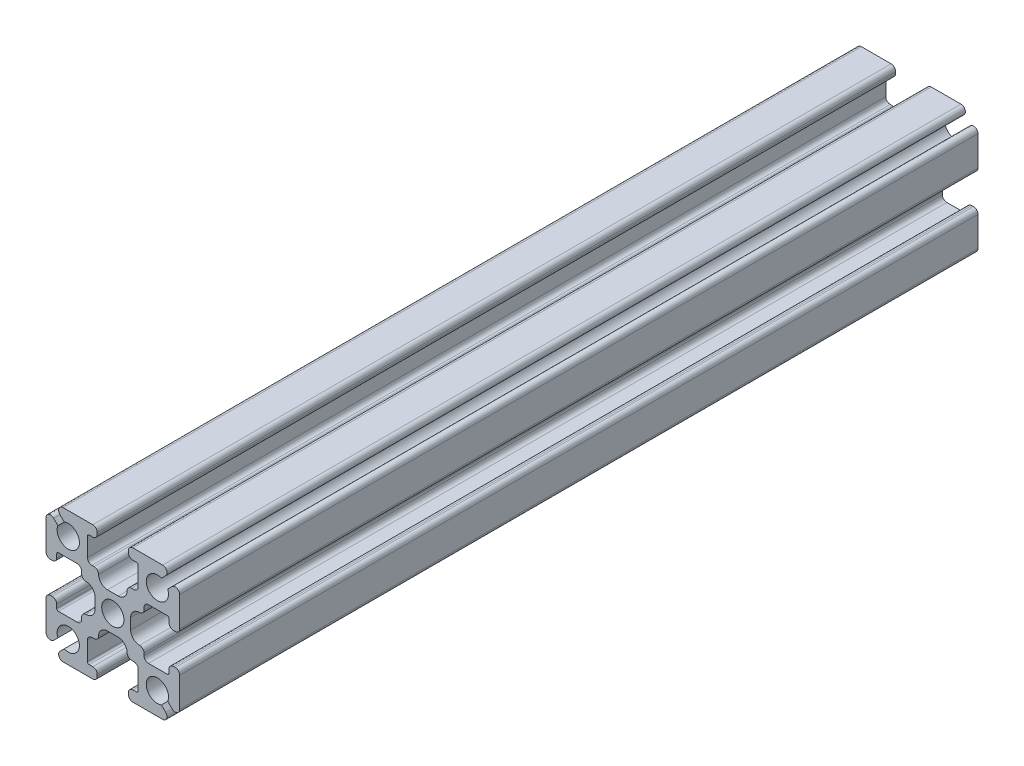
from build123d import *

# Parameters (mm, degrees)
SKETCH1_R           = 1.25
BOSS_EXTRUDE1_DEPTH = 89.6


with BuildPart() as part:
    # Sketch1 → Boss-Extrude1 (new body)
    with BuildSketch(Plane.XY):
        with BuildLine():
            Line((6.646446609, 5.939339828), (6.163645978, 5.456539197))
            ThreePointArc((6.163645978, 5.456539197), (4.116116524, 4.116116524), (5.456539197, 6.163645978))
            Line((5.456539197, 6.163645978), (5.939339828, 6.646446609))
            ThreePointArc((5.939339828, 6.646446609), (6.047726204, 7.191341716), (5.585786438, 7.5))
            Line((5.585786438, 7.5), (2.25, 7.5))
            ThreePointArc((2.25, 7.5), (1.896446609, 7.353553391), (1.75, 7))
            Line((1.75, 7), (1.75, 6.8))
            ThreePointArc((1.75, 6.8), (1.896446609, 6.446446609), (2.25, 6.3))
            Line((2.25, 6.3), (2.65, 6.3))
            ThreePointArc((2.65, 6.3), (2.791421356, 6.241421356), (2.85, 6.1))
            Line((2.85, 6.1), (2.85, 4))
            ThreePointArc((2.85, 4), (2.703553391, 3.646446609), (2.35, 3.5))
            Line((2.35, 3.5), (2.1, 3.5))
            ThreePointArc((2.1, 3.5), (1.746446609, 3.353553391), (1.6, 3))
            ThreePointArc((1.6, 3), (1.307106781, 2.292893219), (0.6, 2))
            Line((0.6, 2), (-0.6, 2))
            ThreePointArc((-0.6, 2), (-1.307106781, 2.292893219), (-1.6, 3))
            ThreePointArc((-1.6, 3), (-1.746446609, 3.353553391), (-2.1, 3.5))
            Line((-2.1, 3.5), (-2.35, 3.5))
            ThreePointArc((-2.35, 3.5), (-2.703553391, 3.646446609), (-2.85, 4))
            Line((-2.85, 4), (-2.85, 6.1))
            ThreePointArc((-2.85, 6.1), (-2.791421356, 6.241421356), (-2.65, 6.3))
            Line((-2.65, 6.3), (-2.25, 6.3))
            ThreePointArc((-2.25, 6.3), (-1.896446609, 6.446446609), (-1.75, 6.8))
            Line((-1.75, 6.8), (-1.75, 7))
            ThreePointArc((-1.75, 7), (-1.896446609, 7.353553391), (-2.25, 7.5))
            Line((-2.25, 7.5), (-5.585786438, 7.5))
            ThreePointArc((-5.585786438, 7.5), (-6.047726204, 7.191341716), (-5.939339828, 6.646446609))
            Line((-5.939339828, 6.646446609), (-5.456539197, 6.163645978))
            ThreePointArc((-5.456539197, 6.163645978), (-4.116116524, 4.116116524), (-6.163645978, 5.456539197))
            Line((-6.163645978, 5.456539197), (-6.646446609, 5.939339828))
            ThreePointArc((-6.646446609, 5.939339828), (-7.191341716, 6.047726204), (-7.5, 5.585786438))
            Line((-7.5, 5.585786438), (-7.5, 2.25))
            ThreePointArc((-7.5, 2.25), (-7.353553391, 1.896446609), (-7, 1.75))
            Line((-7, 1.75), (-6.8, 1.75))
            ThreePointArc((-6.8, 1.75), (-6.446446609, 1.896446609), (-6.3, 2.25))
            Line((-6.3, 2.25), (-6.3, 2.65))
            ThreePointArc((-6.3, 2.65), (-6.241421356, 2.791421356), (-6.1, 2.85))
            Line((-6.1, 2.85), (-4, 2.85))
            ThreePointArc((-4, 2.85), (-3.646446609, 2.703553391), (-3.5, 2.35))
            Line((-3.5, 2.35), (-3.5, 2.1))
            ThreePointArc((-3.5, 2.1), (-3.353553391, 1.746446609), (-3, 1.6))
            ThreePointArc((-3, 1.6), (-2.292893219, 1.307106781), (-2, 0.6))
            Line((-2, 0.6), (-2, -0.6))
            ThreePointArc((-2, -0.6), (-2.292893219, -1.307106781), (-3, -1.6))
            ThreePointArc((-3, -1.6), (-3.353553391, -1.746446609), (-3.5, -2.1))
            Line((-3.5, -2.1), (-3.5, -2.35))
            ThreePointArc((-3.5, -2.35), (-3.646446609, -2.703553391), (-4, -2.85))
            Line((-4, -2.85), (-6.1, -2.85))
            ThreePointArc((-6.1, -2.85), (-6.241421356, -2.791421356), (-6.3, -2.65))
            Line((-6.3, -2.65), (-6.3, -2.25))
            ThreePointArc((-6.3, -2.25), (-6.446446609, -1.896446609), (-6.8, -1.75))
            Line((-6.8, -1.75), (-7, -1.75))
            ThreePointArc((-7, -1.75), (-7.353553391, -1.896446609), (-7.5, -2.25))
            Line((-7.5, -2.25), (-7.5, -5.585786438))
            ThreePointArc((-7.5, -5.585786438), (-7.191341716, -6.047726204), (-6.646446609, -5.939339828))
            Line((-6.646446609, -5.939339828), (-6.163645978, -5.456539197))
            ThreePointArc((-6.163645978, -5.456539197), (-4.116116524, -4.116116524), (-5.456539197, -6.163645978))
            Line((-5.456539197, -6.163645978), (-5.939339828, -6.646446609))
            ThreePointArc((-5.939339828, -6.646446609), (-6.047726204, -7.191341716), (-5.585786438, -7.5))
            Line((-5.585786438, -7.5), (-2.25, -7.5))
            ThreePointArc((-2.25, -7.5), (-1.896446609, -7.353553391), (-1.75, -7))
            Line((-1.75, -7), (-1.75, -6.8))
            ThreePointArc((-1.75, -6.8), (-1.896446609, -6.446446609), (-2.25, -6.3))
            Line((-2.25, -6.3), (-2.65, -6.3))
            ThreePointArc((-2.65, -6.3), (-2.791421356, -6.241421356), (-2.85, -6.1))
            Line((-2.85, -6.1), (-2.85, -4))
            ThreePointArc((-2.85, -4), (-2.703553391, -3.646446609), (-2.35, -3.5))
            Line((-2.35, -3.5), (-2.1, -3.5))
            ThreePointArc((-2.1, -3.5), (-1.746446609, -3.353553391), (-1.6, -3))
            ThreePointArc((-1.6, -3), (-1.307106781, -2.292893219), (-0.6, -2))
            Line((-0.6, -2), (0.6, -2))
            ThreePointArc((0.6, -2), (1.307106781, -2.292893219), (1.6, -3))
            ThreePointArc((1.6, -3), (1.746446609, -3.353553391), (2.1, -3.5))
            Line((2.1, -3.5), (2.35, -3.5))
            ThreePointArc((2.35, -3.5), (2.703553391, -3.646446609), (2.85, -4))
            Line((2.85, -4), (2.85, -6.1))
            ThreePointArc((2.85, -6.1), (2.791421356, -6.241421356), (2.65, -6.3))
            Line((2.65, -6.3), (2.25, -6.3))
            ThreePointArc((2.25, -6.3), (1.896446609, -6.446446609), (1.75, -6.8))
            Line((1.75, -6.8), (1.75, -7))
            ThreePointArc((1.75, -7), (1.896446609, -7.353553391), (2.25, -7.5))
            Line((2.25, -7.5), (5.585786438, -7.5))
            ThreePointArc((5.585786438, -7.5), (6.047726204, -7.191341716), (5.939339828, -6.646446609))
            Line((5.939339828, -6.646446609), (5.456539197, -6.163645978))
            ThreePointArc((5.456539197, -6.163645978), (4.116116524, -4.116116524), (6.163645978, -5.456539197))
            Line((6.163645978, -5.456539197), (6.646446609, -5.939339828))
            ThreePointArc((6.646446609, -5.939339828), (7.191341716, -6.047726204), (7.5, -5.585786438))
            Line((7.5, -5.585786438), (7.5, -2.25))
            ThreePointArc((7.5, -2.25), (7.353553391, -1.896446609), (7, -1.75))
            Line((7, -1.75), (6.8, -1.75))
            ThreePointArc((6.8, -1.75), (6.446446609, -1.896446609), (6.3, -2.25))
            Line((6.3, -2.25), (6.3, -2.65))
            ThreePointArc((6.3, -2.65), (6.241421356, -2.791421356), (6.1, -2.85))
            Line((6.1, -2.85), (4, -2.85))
            ThreePointArc((4, -2.85), (3.646446609, -2.703553391), (3.5, -2.35))
            Line((3.5, -2.35), (3.5, -2.1))
            ThreePointArc((3.5, -2.1), (3.353553391, -1.746446609), (3, -1.6))
            ThreePointArc((3, -1.6), (2.292893219, -1.307106781), (2, -0.6))
            Line((2, -0.6), (2, 0.6))
            ThreePointArc((2, 0.6), (2.292893219, 1.307106781), (3, 1.6))
            ThreePointArc((3, 1.6), (3.353553391, 1.746446609), (3.5, 2.1))
            Line((3.5, 2.1), (3.5, 2.35))
            ThreePointArc((3.5, 2.35), (3.646446609, 2.703553391), (4, 2.85))
            Line((4, 2.85), (6.1, 2.85))
            ThreePointArc((6.1, 2.85), (6.241421356, 2.791421356), (6.3, 2.65))
            Line((6.3, 2.65), (6.3, 2.25))
            ThreePointArc((6.3, 2.25), (6.446446609, 1.896446609), (6.8, 1.75))
            Line((6.8, 1.75), (7, 1.75))
            ThreePointArc((7, 1.75), (7.353553391, 1.896446609), (7.5, 2.25))
            Line((7.5, 2.25), (7.5, 5.585786438))
            ThreePointArc((7.5, 5.585786438), (7.191341716, 6.047726204), (6.646446609, 5.939339828))
        make_face()
        with Locations(Location((0, 0, 0), (0, 0, 180))):
            Circle(SKETCH1_R, mode=Mode.SUBTRACT)
    extrude(amount=BOSS_EXTRUDE1_DEPTH)


solid = part.part
